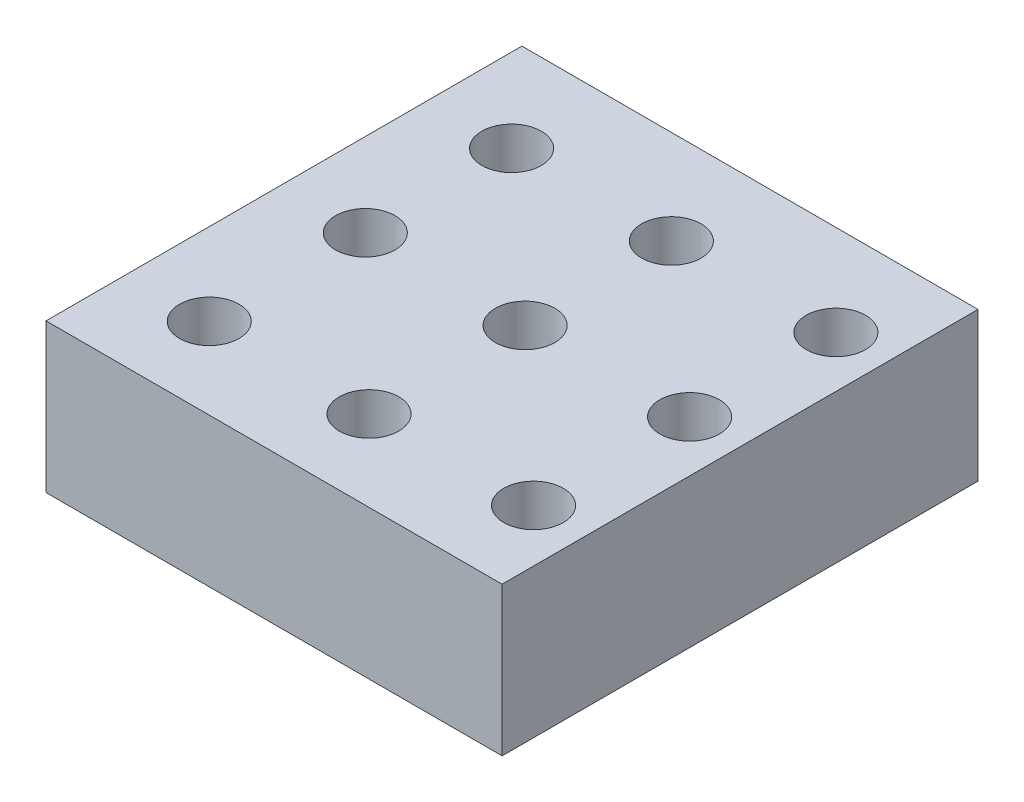
from build123d import *

# Parameters (mm, degrees)
SKETCH1_W           = 30.667590512
SKETCH1_H           = 32
SKETCH1_R           = 2
BOSS_EXTRUDE1_DEPTH = 10


with BuildPart() as part:
    # Sketch1 → Boss-Extrude1 (new body)
    with BuildSketch(Plane(origin=(0, 0, 0), x_dir=(1, 0, 0), z_dir=(0, 1, 0))):
        with Locations((15.333795256, -16)):
            Rectangle(SKETCH1_W, SKETCH1_H)
        with Locations(Location((5.60735534, -6.301960844, 0), (0, 0, 270))):
            Circle(SKETCH1_R, mode=Mode.SUBTRACT)
        with Locations(Location((5.60735534, -16.136396974, 0), (0, 0, 270))):
            Circle(SKETCH1_R, mode=Mode.SUBTRACT)
        with Locations(Location((5.517162454, -26.540056621, 0), (0, 0, 270))):
            Circle(SKETCH1_R, mode=Mode.SUBTRACT)
        with Locations(Location((16.371624777, -6.322368865, 0), (0, 0, 270))):
            Circle(SKETCH1_R, mode=Mode.SUBTRACT)
        with Locations(Location((16.371624777, -16.156804995, 0), (0, 0, 270))):
            Circle(SKETCH1_R, mode=Mode.SUBTRACT)
        with Locations(Location((16.281431892, -26.560464642, 0), (0, 0, 270))):
            Circle(SKETCH1_R, mode=Mode.SUBTRACT)
        with Locations(Location((27.228691902, -6.118288656, 0), (0, 0, 270))):
            Circle(SKETCH1_R, mode=Mode.SUBTRACT)
        with Locations(Location((27.228691902, -15.952724786, 0), (0, 0, 270))):
            Circle(SKETCH1_R, mode=Mode.SUBTRACT)
        with Locations(Location((27.138499016, -26.356384433, 0), (0, 0, 270))):
            Circle(SKETCH1_R, mode=Mode.SUBTRACT)
    extrude(amount=BOSS_EXTRUDE1_DEPTH)


solid = part.part
